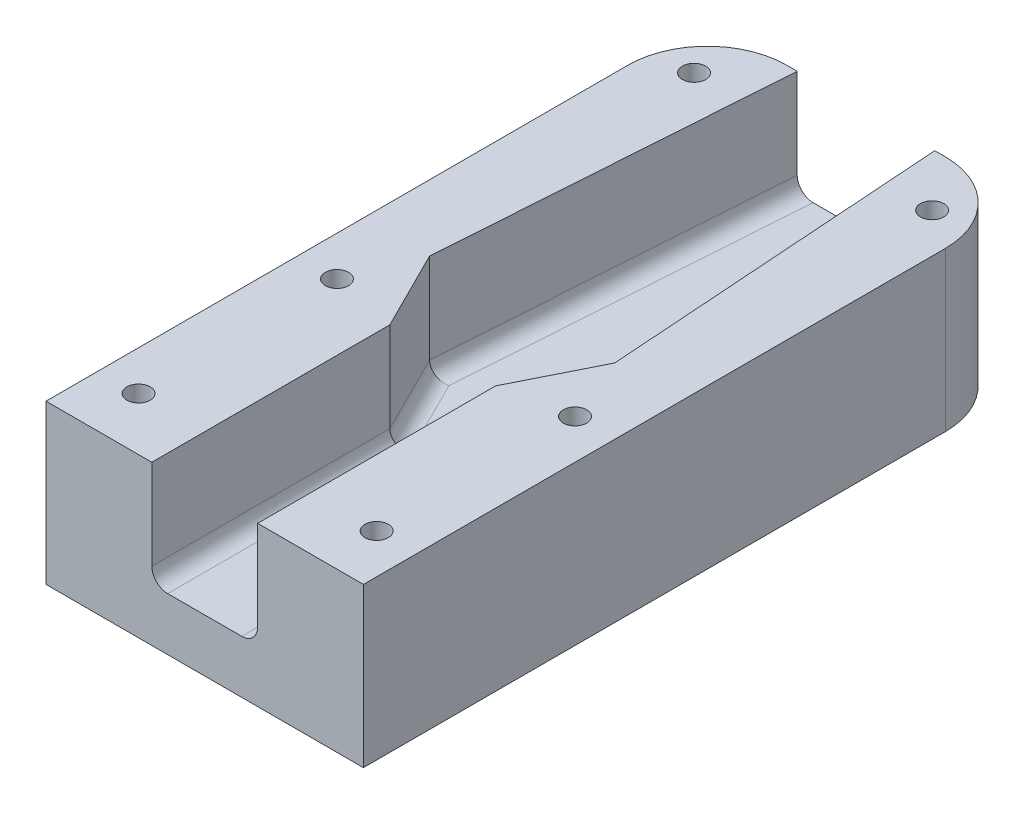
from build123d import *

# Parameters (mm, degrees)
SKETCH_1_W          = 60
SKETCH_1_H          = 125
EXTRUDE_1_DEPTH     = 30
CUT_EXTRUDE_1_DEPTH = 76.539724649
CUT_EXTRUDE_2_DEPTH = 76.539724649
SKETCH_4_W          = 13
SKETCH_4_H          = 65
CUT_EXTRUDE_3_DEPTH = 20
FILLET_1_R          = 3
FILLET_2_R          = 15
SKETCH_5_R          = 3.75
CUT_EXTRUDE_4_DEPTH = 20


with BuildPart() as part:
    # 草图1 → 凸台-拉伸1 (new body)
    with BuildSketch(Plane(origin=(0, 0, 0), x_dir=(1, 0, 0), z_dir=(0, 1, 0))):
        Rectangle(SKETCH_1_W, SKETCH_1_H)
    extrude(amount=EXTRUDE_1_DEPTH)

    # 草图2 → 切除-拉伸1 (cut, through all)
    with BuildSketch(Plane(origin=(0, 30, 0), x_dir=(1, 0, 0), z_dir=(0, 1, 0))):
        with BuildLine():
            ThreePointArc((-20.3, -52.5), (-20.944365081, -50.944365081), (-22.5, -50.3))
            Line((-22.5, -50.3), (-22.5, -52.5))
            Line((-22.5, -52.5), (-20.3, -52.5))
        make_face()
        with BuildLine():
            Line((-22.5, -52.5), (-22.5, -50.3))
            ThreePointArc((-22.5, -50.3), (-24.055634919, -54.055634919), (-20.3, -52.5))
            Line((-20.3, -52.5), (-22.5, -52.5))
        make_face()
        with BuildLine():
            ThreePointArc((24.7, -52.5), (24.055634919, -50.944365081), (22.5, -50.3))
            Line((22.5, -50.3), (22.5, -52.5))
            Line((22.5, -52.5), (20.3, -52.5))
            ThreePointArc((20.3, -52.5), (22.5, -54.7), (24.7, -52.5))
        make_face()
        with BuildLine():
            Line((22.5, -52.5), (22.5, -50.3))
            ThreePointArc((22.5, -50.3), (20.944365081, -50.944365081), (20.3, -52.5))
            Line((20.3, -52.5), (22.5, -52.5))
        make_face()
        with BuildLine():
            ThreePointArc((-20.3, 52.5), (-24.055634919, 54.055634919), (-22.5, 50.3))
            Line((-22.5, 50.3), (-22.5, 52.5))
            Line((-22.5, 52.5), (-20.3, 52.5))
        make_face()
        with BuildLine():
            Line((-22.5, 52.5), (-22.5, 50.3))
            ThreePointArc((-22.5, 50.3), (-20.944365081, 50.944365081), (-20.3, 52.5))
            Line((-20.3, 52.5), (-22.5, 52.5))
        make_face()
        with BuildLine():
            ThreePointArc((20.3, 52.5), (20.944365081, 50.944365081), (22.5, 50.3))
            Line((22.5, 50.3), (22.5, 52.5))
            Line((22.5, 52.5), (20.3, 52.5))
        make_face()
        with BuildLine():
            Line((22.5, 52.5), (22.5, 50.3))
            ThreePointArc((22.5, 50.3), (24.055634919, 50.944365081), (24.7, 52.5))
            ThreePointArc((24.7, 52.5), (22.5, 54.7), (20.3, 52.5))
            Line((20.3, 52.5), (22.5, 52.5))
        make_face()
    extrude(amount=-CUT_EXTRUDE_1_DEPTH, mode=Mode.SUBTRACT)

    # 草图3 → 切除-拉伸2 (cut, through all)
    with BuildSketch(Plane(origin=(0, 0, 0), x_dir=(-1, 0, 0), z_dir=(0, -1, 0))):
        with BuildLine():
            ThreePointArc((-20.3, -15), (-20.906792195, -13.482868203), (-22.392444444, -12.802630709))
            ThreePointArc((-22.392444444, -12.802630709), (-22.473095025, -13.9), (-22.5, -15))
            Line((-22.5, -15), (-20.3, -15))
        make_face()
        with BuildLine():
            ThreePointArc((-22.5, -15), (-22.473095025, -13.9), (-22.392444444, -12.802630709))
            ThreePointArc((-22.392444444, -12.802630709), (-24.017131797, -13.406792195), (-24.7, -15))
            Line((-24.7, -15), (-22.5, -15))
        make_face()
        with BuildLine():
            ThreePointArc((-24.7, -15), (-24.017131797, -16.593207805), (-22.392444444, -17.197369291))
            ThreePointArc((-22.392444444, -17.197369291), (-22.473095025, -16.1), (-22.5, -15))
            Line((-22.5, -15), (-24.7, -15))
        make_face()
        with BuildLine():
            ThreePointArc((-22.5, -15), (-22.473095025, -16.1), (-22.392444444, -17.197369291))
            ThreePointArc((-22.392444444, -17.197369291), (-20.906792195, -16.517131797), (-20.3, -15))
            Line((-20.3, -15), (-22.5, -15))
        make_face()
        with BuildLine():
            ThreePointArc((22.392444444, -17.197369291), (24.017131797, -16.593207805), (24.7, -15))
            Line((24.7, -15), (22.5, -15))
            ThreePointArc((22.5, -15), (22.473095025, -16.1), (22.392444444, -17.197369291))
        make_face()
        with BuildLine():
            Line((22.5, -15), (24.7, -15))
            ThreePointArc((24.7, -15), (24.017131797, -13.406792195), (22.392444444, -12.802630709))
            ThreePointArc((22.392444444, -12.802630709), (22.473095025, -13.9), (22.5, -15))
        make_face()
        with BuildLine():
            ThreePointArc((22.392444444, -17.197369291), (22.473095025, -16.1), (22.5, -15))
            Line((22.5, -15), (20.3, -15))
            ThreePointArc((20.3, -15), (20.906792195, -16.517131797), (22.392444444, -17.197369291))
        make_face()
        with BuildLine():
            Line((20.3, -15), (22.5, -15))
            ThreePointArc((22.5, -15), (22.473095025, -13.9), (22.392444444, -12.802630709))
            ThreePointArc((22.392444444, -12.802630709), (20.906792195, -13.482868203), (20.3, -15))
        make_face()
    extrude(amount=-CUT_EXTRUDE_2_DEPTH, mode=Mode.SUBTRACT)

    # 草图4 → 切除-拉伸3 (cut)
    with BuildSketch(Plane(origin=(0, 30, 0), x_dir=(1, 0, 0), z_dir=(0, 1, 0))):
        Polygon((0, -2.5), (0, -62.5), (10, -62.5), (10, -17.5), (17.5, -2.5), (13, -2.5), align=None)
        Polygon((-10, -62.5), (0, -62.5), (0, -2.5), (-13, -2.5), (-17.5, -2.5), (-10, -17.5), align=None)
        Polygon((-17.5, -2.5), (-13, -2.5), (-13, 62.5), align=None)
        with Locations((-6.5, 30)):
            Rectangle(SKETCH_4_W, SKETCH_4_H)
        with Locations((6.5, 30)):
            Rectangle(SKETCH_4_W, SKETCH_4_H)
        Polygon((13, 62.5), (13, -2.5), (17.5, -2.5), align=None)
    extrude(amount=-CUT_EXTRUDE_3_DEPTH, mode=Mode.SUBTRACT)

    # 圆角1
    fillet_1_edges = [part.edges().sort_by_distance(p)[0] for p in [
        (10, 10, 40),
        (-15.25, 10, -30),
        (15.25, 10, -30),
        (13.75, 10, 10),
        (-10, 10, 40),
        (-13.75, 10, 10),
    ]]
    fillet(fillet_1_edges, radius=FILLET_1_R)

    # 圆角2
    fillet_2_edges = [part.edges().sort_by_distance(p)[0] for p in [
        (-30, 15, -62.5),
        (30, 15, -62.5),
    ]]
    fillet(fillet_2_edges, radius=FILLET_2_R)

    # 草图5 → 切除-拉伸4 (cut)
    with BuildSketch(Plane.XZ):
        with Locations(Location((-22.5, -52.5, 0), (0, 0, 270))):
            Circle(SKETCH_5_R)
        with Locations(Location((22.5, -52.5, 0), (0, 0, 270))):
            Circle(SKETCH_5_R)
        with Locations(Location((-22.5, 15, 0), (0, 0, 270))):
            Circle(SKETCH_5_R)
        with Locations(Location((22.5, 15, 0), (0, 0, 270))):
            Circle(SKETCH_5_R)
        with Locations(Location((-22.5, 52.5, 0), (0, 0, 270))):
            Circle(SKETCH_5_R)
        with Locations(Location((22.5, 52.5, 0), (0, 0, 270))):
            Circle(SKETCH_5_R)
    extrude(amount=-CUT_EXTRUDE_4_DEPTH, mode=Mode.SUBTRACT)


solid = part.part
